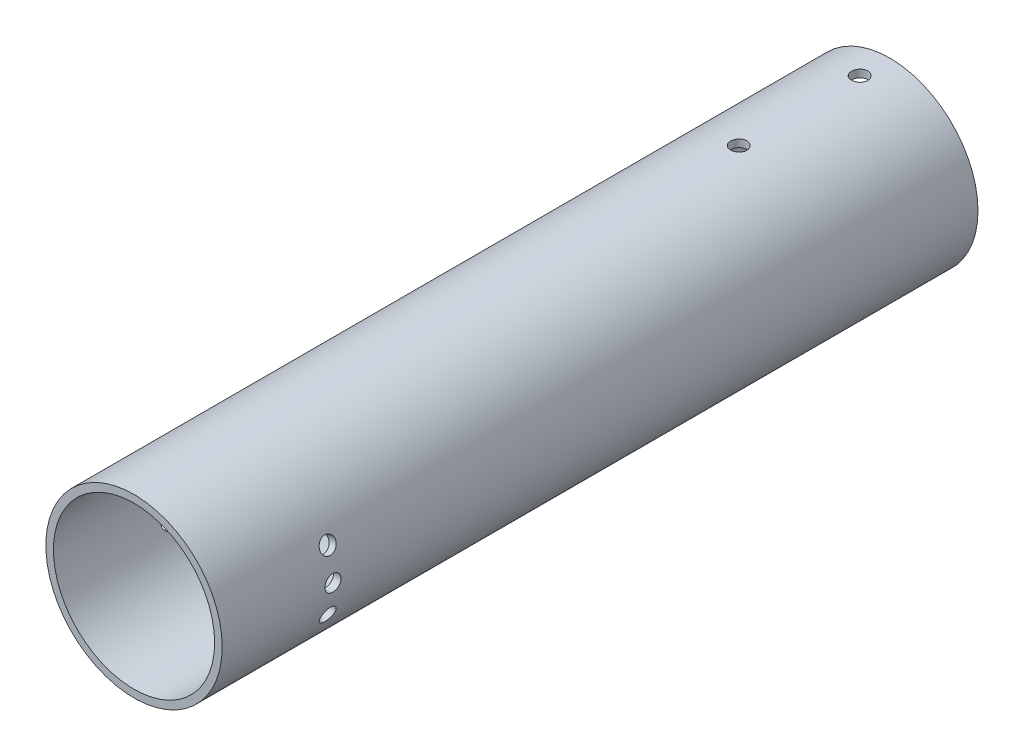
from build123d import *

# Parameters (mm, degrees)
SKETCH_1_R          = 17.5
SKETCH_1_R_2        = 16
EXTRUDE_1_DEPTH     = 150
SKETCH_2_R          = 1.6
CUT_EXTRUDE_1_DEPTH = 25
SKETCH_5_R          = 1.6
CUT_EXTRUDE_3_DEPTH = 138.461236575
SKETCH_6_R          = 1.6
CUT_EXTRUDE_4_DEPTH = 25


with BuildPart() as part:
    # 草图1 → 凸台-拉伸1 (new body)
    with BuildSketch(Plane.XY):
        Circle(SKETCH_1_R)
        Circle(SKETCH_1_R_2, mode=Mode.SUBTRACT)
    extrude(amount=EXTRUDE_1_DEPTH)

    # 草图2 → 切除-拉伸1 (cut, symmetric)
    with BuildSketch(Plane(origin=(0, 0, 0), x_dir=(1, 0, 0), z_dir=(0, 1, 0))):
        with Locations(Location((0, -6, 0), (0, 0, 270))):
            Circle(SKETCH_2_R)
        with Locations(Location((0, -30, 0), (0, 0, 270))):
            Circle(SKETCH_2_R)
    extrude(amount=CUT_EXTRUDE_1_DEPTH, both=True, mode=Mode.SUBTRACT)

    # 草图5 → 切除-拉伸3 (cut, through all)
    with BuildSketch(Plane(origin=(24.979117188, 9.091655135, 128), x_dir=(0.3420201433256663, -0.9396926207859093, 0), z_dir=(0.9396926207859093, 0.3420201433256663, 0))):
        with Locations(Location((0, 0, 0), (0, 0, 180))):
            Circle(SKETCH_5_R)
    cut_extrude_3 = extrude(amount=-CUT_EXTRUDE_3_DEPTH, mode=Mode.SUBTRACT)

    # 镜向1: 切除-拉伸3 across plane
    add(cut_extrude_3.mirror(Plane(origin=(0, 0, 0), x_dir=(0, 0, 1), z_dir=(1, 0, 0))), mode=Mode.SUBTRACT)

    # 草图6 → 切除-拉伸4 (cut, symmetric)
    with BuildSketch(Plane(origin=(0, 0, 0), x_dir=(0, 0, -1), z_dir=(1, 0, 0))):
        with Locations((-128, 0)):
            Circle(SKETCH_6_R)
    extrude(amount=CUT_EXTRUDE_4_DEPTH, both=True, mode=Mode.SUBTRACT)


solid = part.part
